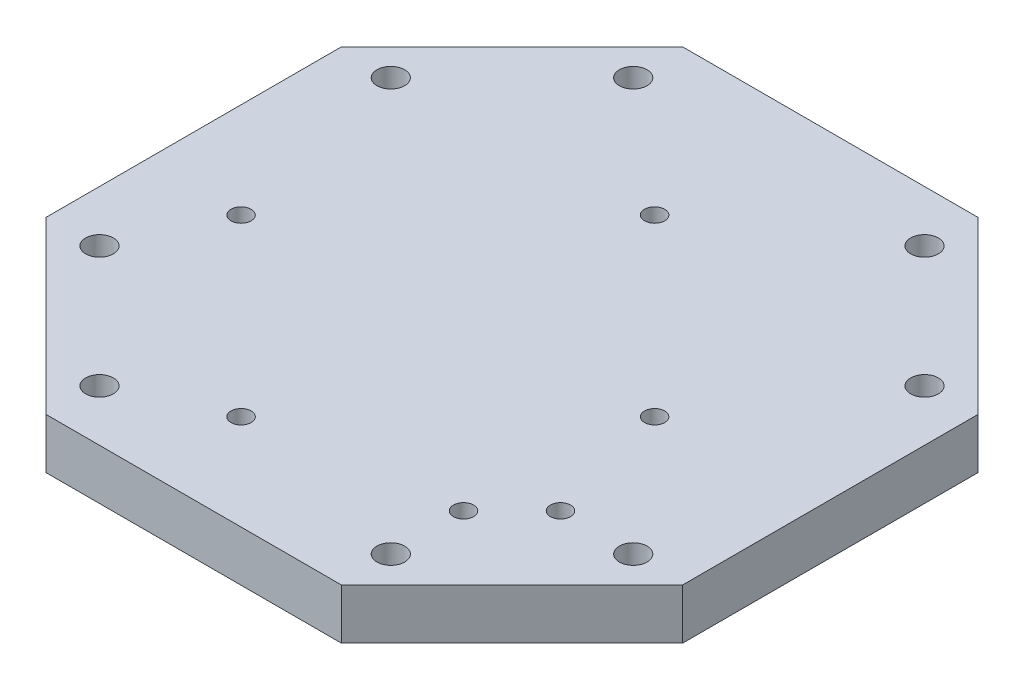
from build123d import *

# Parameters (mm, degrees)
BOSS_EXTRU_1_DEPTH                                   = 10
CHAMBRAGE_POUR_T_TE_CYLINDRIQUE_FENDUE_M_D           = 4
CHAMBRAGE_POUR_T_TE_CYLINDRIQUE_FENDUE_M_CBORE_D     = 5.5
CHAMBRAGE_POUR_T_TE_CYLINDRIQUE_FENDUE_M_CBORE_DEPTH = 4
ESQUISSE6_R                                          = 2
ENL_V_MAT_EXTRU_1_DEPTH                              = 90.844829046


with BuildPart() as part:
    # Esquisse1 → Boss.-Extru.1 (new body)
    with BuildSketch(Plane(origin=(0, 0, 0), x_dir=(1, 0, 0), z_dir=(0, 1, 0))):
        Polygon((63.135145942, -29.291431628), (63.135145942, 29.291431628), (29.291431628, 63.135145942), (-29.291431628, 63.135145942), (-63.135145942, 29.291431628), (-63.135145942, -29.291431628), (-29.291431628, -63.135145942), (29.291431628, -63.135145942), align=None)
    extrude(amount=BOSS_EXTRU_1_DEPTH)

    # Chambrage pour tête cylindrique fendue M31 (through all)
    with Locations(Plane(origin=(-28.889172646, 10, -52.930803206), x_dir=(0, 0, 1), z_dir=(0, 1, 0))):
        with Locations((0, 0), (24.04163056, -24.04163056), (81.819975852, -24.04163056), (105.861606412, 0), (105.861606412, 57.778345292), (81.819975852, 81.819975852), (24.04163056, 81.819975852), (0, 57.778345292)):
            CounterBoreHole(CHAMBRAGE_POUR_T_TE_CYLINDRIQUE_FENDUE_M_D / 2, CHAMBRAGE_POUR_T_TE_CYLINDRIQUE_FENDUE_M_CBORE_D / 2, CHAMBRAGE_POUR_T_TE_CYLINDRIQUE_FENDUE_M_CBORE_DEPTH)

    # Esquisse6 → Enlèv. mat.-Extru.1 (cut, through all)
    with BuildSketch(Plane.XZ):
        with Locations(Location((-44.194173824, 9.545941546, 0), (0, 0, 270))):
            Circle(ESQUISSE6_R)
        with Locations(Location((-9.545941546, 44.194173824, 0), (0, 0, 270))):
            Circle(ESQUISSE6_R)
        with Locations(Location((-3.181980515, -31.466251763, 0), (0, 0, 270))):
            Circle(ESQUISSE6_R)
        with Locations(Location((31.466251763, 3.181980515, 0), (0, 0, 270))):
            Circle(ESQUISSE6_R)
        with Locations(Location((28.677040611, 38.293692836, 0), (0, 0, 270))):
            Circle(ESQUISSE6_R)
        with Locations(Location((38.293692836, 28.677040611, 0), (0, 0, 270))):
            Circle(ESQUISSE6_R)
    extrude(amount=-ENL_V_MAT_EXTRU_1_DEPTH, mode=Mode.SUBTRACT)


solid = part.part
